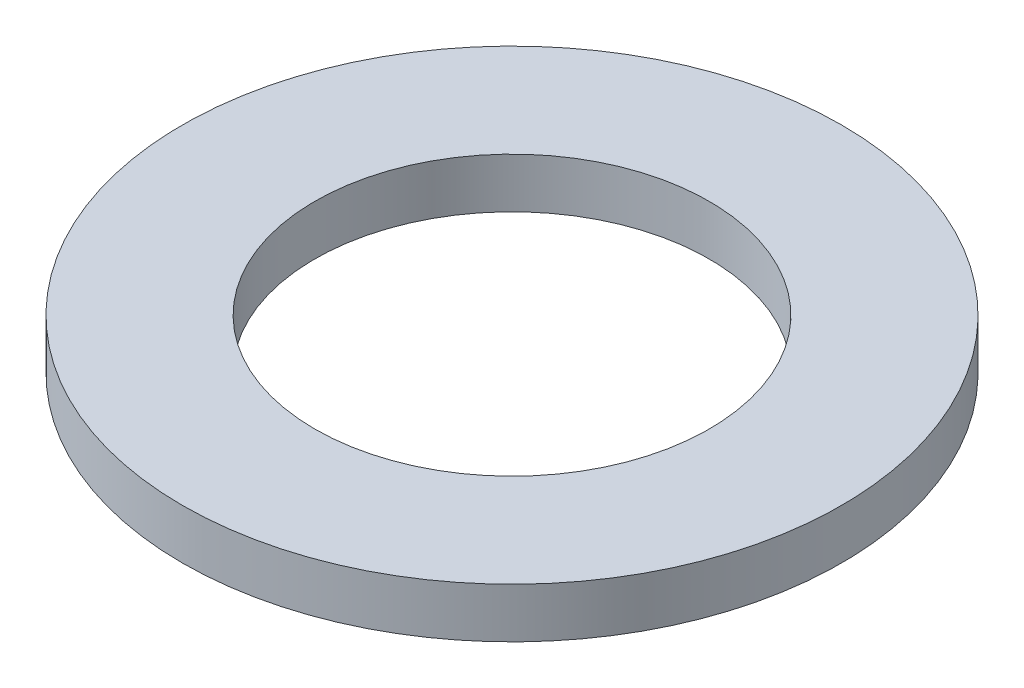
from build123d import *

# Parameters (mm, degrees)
SKETCH1_R           = 1.6764
SKETCH1_R_2         = 1.0033
BOSS_EXTRUDE1_DEPTH = 0.254


with BuildPart() as part:
    # Sketch1 → Boss-Extrude1 (new body)
    with BuildSketch(Plane(origin=(0, 0, 0), x_dir=(1, 0, 0), z_dir=(0, 1, 0))):
        with Locations(Location((0, 0, 0), (0, 0, 270))):
            Circle(SKETCH1_R)
        with Locations(Location((0, 0, 0), (0, 0, 270))):
            Circle(SKETCH1_R_2, mode=Mode.SUBTRACT)
    extrude(amount=BOSS_EXTRUDE1_DEPTH)


solid = part.part
